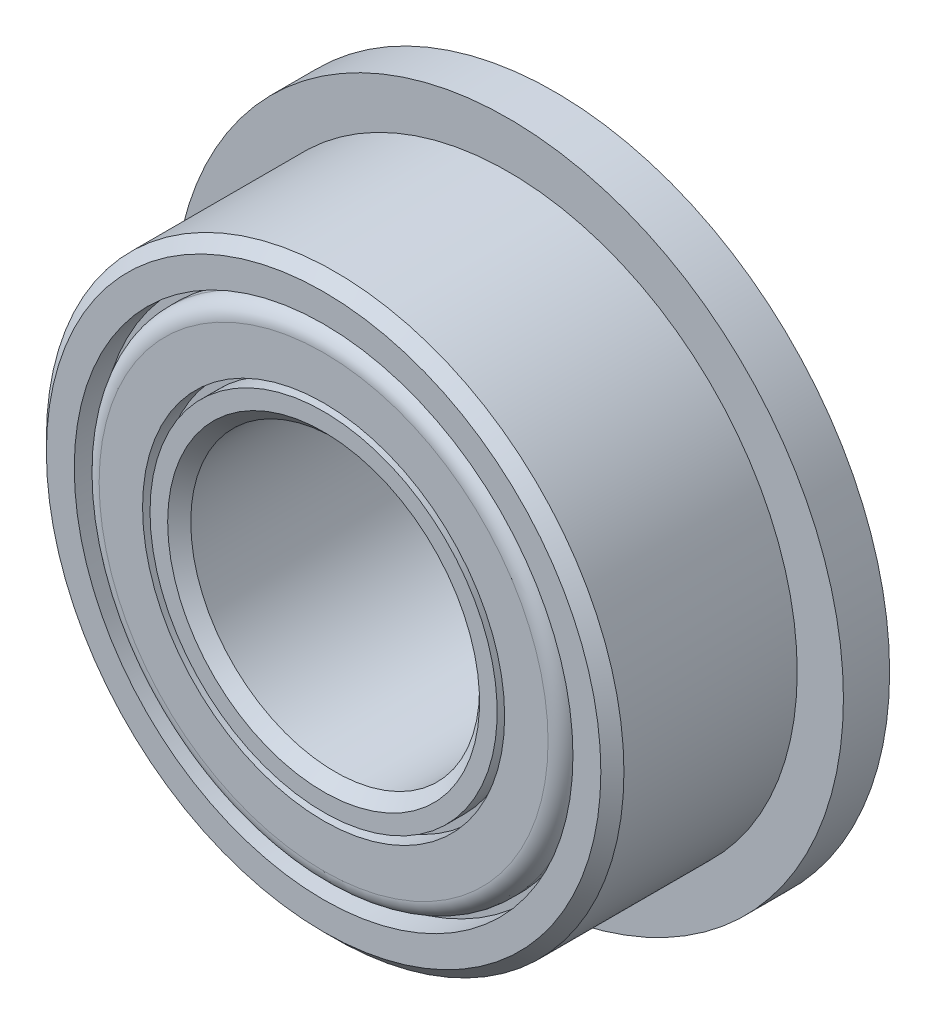
from build123d import *

# Parameters (mm, degrees)
CHAMFER1_SIZE = 0.2
FILLET1_R     = 0.3


with BuildPart() as part:
    # Sketch1 → Revolve1 (revolve)
    with BuildSketch(Plane(origin=(0, 0, 0), x_dir=(0, 0, -1), z_dir=(1, 0, 0)), mode=Mode.PRIVATE) as revolve1_sk:
        Polygon((-2, 2.5), (2, 2.5), (2, 5.8), (1.2, 5.8), (1.2, 5), (-2, 5), align=None)
    revolve(revolve1_sk.sketch.rotate(Axis((0, 0, 0), (0, 0, -1)), 90), axis=Axis((0, 0, 0), (0, 0, -1)))

    # Chamfer1
    chamfer1_edges = [part.edges().sort_by_distance(p)[0] for p in [
        (-5, 0, 2),
        (-2.5, 0, -2),
        (-2.5, 0, 2),
    ]]
    chamfer(chamfer1_edges, length=CHAMFER1_SIZE)

    # Sketch2 → Cut-Revolve1 (revolve, cut)
    with BuildSketch(Plane(origin=(0, 0, 0), x_dir=(0, 0, -1), z_dir=(1, 0, 0)), mode=Mode.PRIVATE) as cut_revolve1_sk:
        Polygon((-2, 4.317089392), (-1.556756286, 4.317089392), (-1.556756286, 4.186077714), (-2, 4.186077714), (-2, 3.134478417), (-1.668024824, 3.134478417), (-1.668024824, 3.005528354), (-2, 3.005528354), (-2, 2.264675566), (-2.552130355, 2.264675566), (-2.552130355, 4.329651261), (-2, 4.329651261), align=None)
    cut_revolve1 = revolve(cut_revolve1_sk.sketch.rotate(Axis((0, 0, -2), (0, 0, 1)), 90), axis=Axis((0, 0, -2), (0, 0, 1)), mode=Mode.SUBTRACT)

    # Mirror3: Cut-Revolve1 across plane
    add(cut_revolve1.mirror(Plane.XY), mode=Mode.SUBTRACT)

    # Fillet1
    fillet1_edges = [part.edges().sort_by_distance(p)[0] for p in [
        (4.186077714, 0, 2),
        (4.186077714, 0, -2),
    ]]
    fillet(fillet1_edges, radius=FILLET1_R)


solid = part.part
